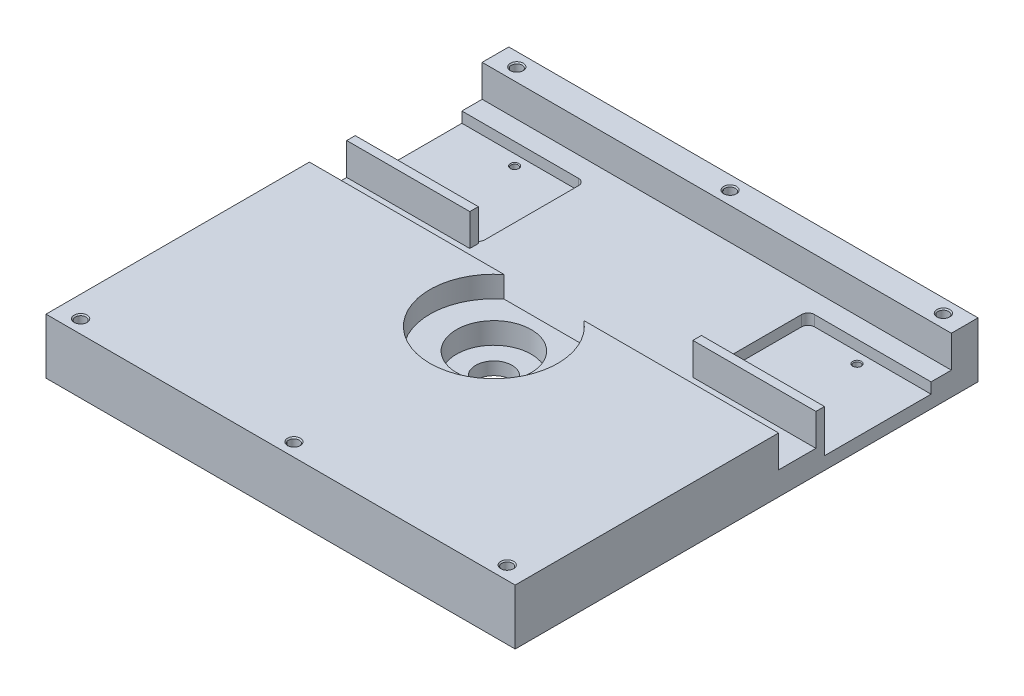
from build123d import *

# Parameters (mm, degrees)
SKETCH1_W                       = 220
SKETCH1_H                       = 217
BLOCO_BRUTO_DEPTH               = 26
SKETCH2_R                       = 8.5
FURO_17_PASSANTE_DEPTH          = 157.678811586
SKETCH2_3_R                     = 17.5
SKETCH2_3_R_2                   = 8.5
REBAIXO_35X20_DEPTH             = 20
SKETCH2_4_R                     = 30
SKETCH2_4_R_2                   = 17.5
REBAIXO_60X10_DEPTH             = 10
REBAIXO_220X81X15_DEPTH         = 15
REBAIXO_ENCAIXE_MANCAIS_DEPTH   = 5
M6X1_0_FUROS_APOIO_D            = 5
M6X1_0_FUROS_APOIO_DEPTH        = 17
M6X1_0_FUROS_APOIO_CSINK_D      = 6.05
M6X1_0_FUROS_APOIO_CSINK_ANGLE  = 90
M6X1_0_FUROS_APOIO_TIP          = 1.502151548
M4X0_7_TAPPED_HOLE1_D           = 3.3
M4X0_7_TAPPED_HOLE1_DEPTH       = 11.5
M4X0_7_TAPPED_HOLE1_CSINK_D     = 4.05
M4X0_7_TAPPED_HOLE1_CSINK_ANGLE = 90
M4X0_7_TAPPED_HOLE1_TIP         = 0.991420021


with BuildPart() as part:
    # Sketch1 → Bloco (Bruto) (new body)
    with BuildSketch(Plane(origin=(0, 0, 0), x_dir=(1, 0, 0), z_dir=(0, 1, 0))):
        Rectangle(SKETCH1_W, SKETCH1_H)
    extrude(amount=BLOCO_BRUTO_DEPTH)

    # Sketch2 → Furo Ø17 Passante (cut, through all)
    with BuildSketch(Plane(origin=(0, 26, 0), x_dir=(1, 0, 0), z_dir=(0, 1, 0))):
        with Locations(Location((0, -8.5, 0), (0, 0, 270))):
            Circle(SKETCH2_R)
    extrude(amount=-FURO_17_PASSANTE_DEPTH, mode=Mode.SUBTRACT)

    # Sketch2<3> → Rebaixo Ø35x20 (cut)
    with BuildSketch(Plane(origin=(0, 26, 0), x_dir=(1, 0, 0), z_dir=(0, 1, 0))):
        with Locations(Location((0, -8.5, 0), (0, 0, 270))):
            Circle(SKETCH2_3_R)
        with Locations(Location((0, -8.5, 0), (0, 0, 270))):
            Circle(SKETCH2_3_R_2, mode=Mode.SUBTRACT)
    extrude(amount=-REBAIXO_35X20_DEPTH, mode=Mode.SUBTRACT)

    # Sketch2<4> → Rebaixo Ø60x10 (cut)
    with BuildSketch(Plane(origin=(0, 26, 0), x_dir=(1, 0, 0), z_dir=(0, 1, 0))):
        with Locations(Location((0, -8.5, 0), (0, 0, 270))):
            Circle(SKETCH2_4_R)
        with Locations(Location((0, -8.5, 0), (0, 0, 270))):
            Circle(SKETCH2_4_R_2, mode=Mode.SUBTRACT)
    extrude(amount=-REBAIXO_60X10_DEPTH, mode=Mode.SUBTRACT)

    # Sketch3 → Rebaixo 220x81x15 (cut)
    with BuildSketch(Plane(origin=(0, 26, 0), x_dir=(1, 0, 0), z_dir=(0, 1, 0))):
        with BuildLine():
            ThreePointArc((18.648056199, 15), (9.874208829, 19.828430948), (0, 21.5))
            Line((0, 21.5), (0, 15))
            Line((0, 15), (18.648056199, 15))
        make_face()
        with BuildLine():
            Line((0, 15), (0, 21.5))
            ThreePointArc((0, 21.5), (-9.874208829, 19.828430948), (-18.648056199, 15))
            Line((-18.648056199, 15), (0, 15))
        make_face()
        with BuildLine():
            Line((110, 36.5), (110, 96))
            Line((110, 96), (0, 96))
            Line((0, 96), (0, 21.5))
            ThreePointArc((0, 21.5), (9.874208829, 19.828430948), (18.648056199, 15))
            Line((18.648056199, 15), (110, 15))
            Line((110, 15), (110, 32.5))
            Line((110, 32.5), (52.3, 32.5))
            Line((52.3, 32.5), (52.3, 36.5))
            Line((52.3, 36.5), (110, 36.5))
        make_face()
        with BuildLine():
            Line((0, 21.5), (0, 96))
            Line((0, 96), (-110, 96))
            Line((-110, 96), (-110, 36.5))
            Line((-110, 36.5), (-52.3, 36.5))
            Line((-52.3, 36.5), (-52.3, 32.5))
            Line((-52.3, 32.5), (-110, 32.5))
            Line((-110, 32.5), (-110, 15))
            Line((-110, 15), (-18.648056199, 15))
            ThreePointArc((-18.648056199, 15), (-9.874208829, 19.828430948), (0, 21.5))
        make_face()
    extrude(amount=-REBAIXO_220X81X15_DEPTH, mode=Mode.SUBTRACT)

    # Sketch4 → Rebaixo - Encaixe Mancais (cut)
    with BuildSketch(Plane(origin=(0, 11, 0), x_dir=(1, 0, 0), z_dir=(0, 1, 0))):
        with BuildLine():
            Line((-110, 86.5), (-55.3, 86.5))
            ThreePointArc((-55.3, 86.5), (-53.178679656, 85.621320344), (-52.3, 83.5))
            Line((-52.3, 83.5), (-52.3, 39.5))
            ThreePointArc((-52.3, 39.5), (-53.178679656, 37.378679656), (-55.3, 36.5))
            Line((-55.3, 36.5), (-110, 36.5))
            Line((-110, 36.5), (-110, 86.5))
        make_face()
        with BuildLine():
            Line((110, 36.5), (55.3, 36.5))
            ThreePointArc((55.3, 36.5), (53.178679656, 37.378679656), (52.3, 39.5))
            Line((52.3, 39.5), (52.3, 83.5))
            ThreePointArc((52.3, 83.5), (53.178679656, 85.621320344), (55.3, 86.5))
            Line((55.3, 86.5), (110, 86.5))
            Line((110, 86.5), (110, 36.5))
        make_face()
    extrude(amount=-REBAIXO_ENCAIXE_MANCAIS_DEPTH, mode=Mode.SUBTRACT)

    # M6x1.0 - Furos Apoio
    with Locations(Plane(origin=(0, 26, 0), x_dir=(1, 0, 0), z_dir=(0, 1, 0))):
        with Locations((-100, -102.25), (0, -102.25), (100, -102.25), (-100, 102.25), (0, 102.25), (100, 102.25)):
            CounterSinkHole(M6X1_0_FUROS_APOIO_D / 2, M6X1_0_FUROS_APOIO_CSINK_D / 2, depth=M6X1_0_FUROS_APOIO_DEPTH, counter_sink_angle=M6X1_0_FUROS_APOIO_CSINK_ANGLE)
            with Locations((0, 0, -(M6X1_0_FUROS_APOIO_DEPTH + M6X1_0_FUROS_APOIO_TIP / 2))):  # 118° drill point
                Cone(0, M6X1_0_FUROS_APOIO_D / 2, M6X1_0_FUROS_APOIO_TIP, mode=Mode.SUBTRACT)

    # M4x0.7 Tapped Hole1
    with Locations(Plane(origin=(0, 6, 0), x_dir=(1, 0, 0), z_dir=(0, 1, 0))):
        with Locations((-80.3, 81.5), (-80.3, 41.5), (80.3, 81.5), (80.3, 41.5)):
            CounterSinkHole(M4X0_7_TAPPED_HOLE1_D / 2, M4X0_7_TAPPED_HOLE1_CSINK_D / 2, depth=M4X0_7_TAPPED_HOLE1_DEPTH, counter_sink_angle=M4X0_7_TAPPED_HOLE1_CSINK_ANGLE)
            with Locations((0, 0, -(M4X0_7_TAPPED_HOLE1_DEPTH + M4X0_7_TAPPED_HOLE1_TIP / 2))):  # 118° drill point
                Cone(0, M4X0_7_TAPPED_HOLE1_D / 2, M4X0_7_TAPPED_HOLE1_TIP, mode=Mode.SUBTRACT)


solid = part.part
